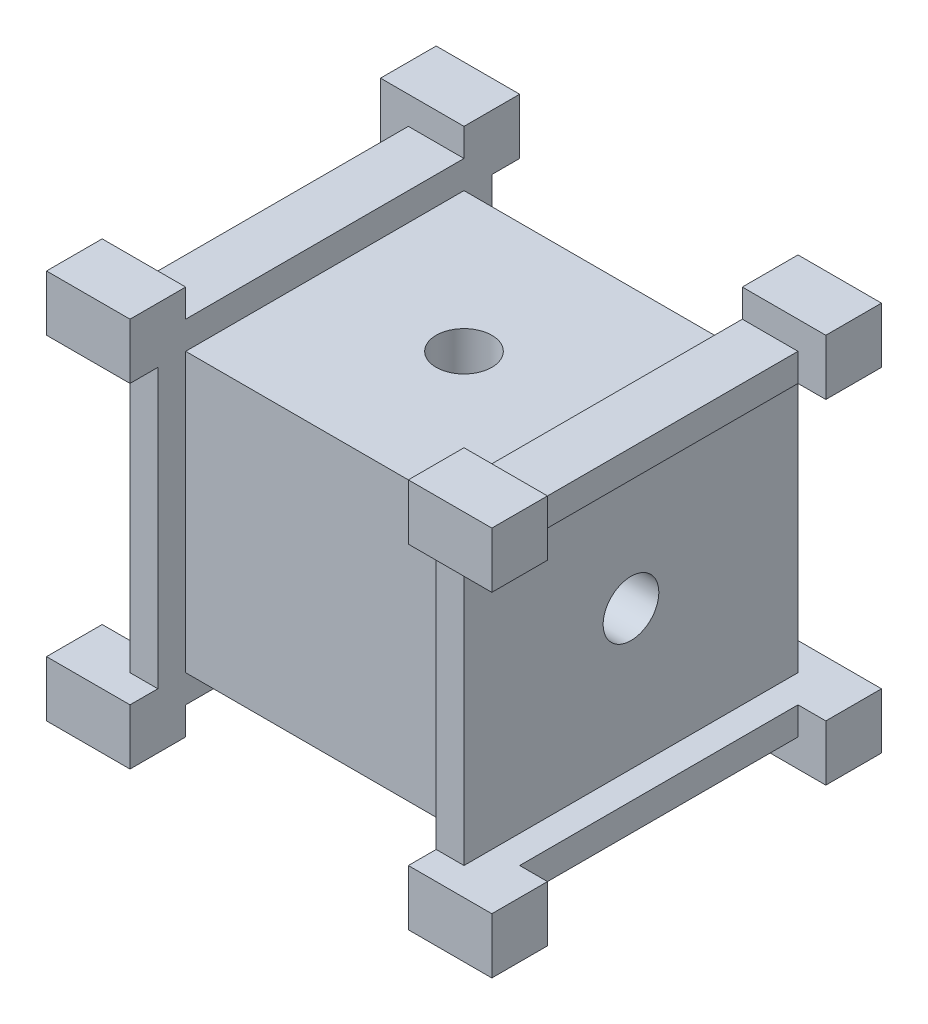
from build123d import *

# Parameters (mm, degrees)
SKETCH1_W            = 12
SKETCH1_H            = 12
BOSS_EXTRUDE1_DEPTH  = 12
SKETCH2_W            = 10
SKETCH2_H            = 12
CUT_EXTRUDE1_DEPTH   = 1
SKETCH3_W            = 10
SKETCH3_H            = 11
CUT_EXTRUDE2_DEPTH   = 1
SKETCH4_W            = 10
SKETCH4_H            = 11
CUT_EXTRUDE3_DEPTH   = 1
SKETCH5_W            = 10
SKETCH5_H            = 10
CUT_EXTRUDE4_DEPTH   = 1
SKETCH6_W            = 12
SKETCH6_H            = 1
BOSS_EXTRUDE2_DEPTH  = 1
SKETCH7_W            = 12
SKETCH7_H            = 1
BOSS_EXTRUDE3_DEPTH  = 1
SKETCH8_W            = 12
SKETCH8_H            = 1
BOSS_EXTRUDE4_DEPTH  = 1
SKETCH12_W           = 2
SKETCH12_H           = 1
BOSS_EXTRUDE5_DEPTH  = 1
SKETCH13_W           = 2
SKETCH13_H           = 1
BOSS_EXTRUDE6_DEPTH  = 1
SKETCH14_W           = 2
SKETCH14_H           = 1
BOSS_EXTRUDE7_DEPTH  = 1
SKETCH16_W           = 2
SKETCH16_H           = 1
BOSS_EXTRUDE8_DEPTH  = 1
SKETCH19_W           = 2
SKETCH19_H           = 1
BOSS_EXTRUDE10_DEPTH = 1
SKETCH20_W           = 2
SKETCH20_H           = 1
BOSS_EXTRUDE11_DEPTH = 1
SKETCH21_W           = 2
SKETCH21_H           = 1
BOSS_EXTRUDE12_DEPTH = 1
SKETCH22_W           = 2
SKETCH22_H           = 1
BOSS_EXTRUDE13_DEPTH = 1
SKETCH23_W           = 1
SKETCH23_H           = 2
BOSS_EXTRUDE15_DEPTH = 1
SKETCH24_W           = 3
SKETCH24_H           = 2
BOSS_EXTRUDE16_DEPTH = 1
SKETCH25_W           = 1
SKETCH25_H           = 2
BOSS_EXTRUDE17_DEPTH = 1
SKETCH26_W           = 1
SKETCH26_H           = 2
BOSS_EXTRUDE19_DEPTH = 1
SKETCH28_W           = 1
SKETCH28_H           = 2
BOSS_EXTRUDE20_DEPTH = 1
SKETCH29_W           = 1
SKETCH29_H           = 2
BOSS_EXTRUDE21_DEPTH = 1
SKETCH30_W           = 1
SKETCH30_H           = 2
BOSS_EXTRUDE22_DEPTH = 1
SKETCH31_W           = 1
SKETCH31_H           = 2
BOSS_EXTRUDE24_DEPTH = 1
SKETCH33_W           = 1
SKETCH33_H           = 2
BOSS_EXTRUDE25_DEPTH = 1
SKETCH34_W           = 3
SKETCH34_H           = 2
BOSS_EXTRUDE26_DEPTH = 1
SKETCH35_W           = 3
SKETCH35_H           = 2
BOSS_EXTRUDE27_DEPTH = 1
SKETCH36_W           = 3
SKETCH36_H           = 2
BOSS_EXTRUDE28_DEPTH = 1
SKETCH37_W           = 3
SKETCH37_H           = 2
BOSS_EXTRUDE29_DEPTH = 1
SKETCH38_W           = 3
SKETCH38_H           = 2
BOSS_EXTRUDE30_DEPTH = 1
SKETCH39_W           = 3
SKETCH39_H           = 2
BOSS_EXTRUDE31_DEPTH = 1
SKETCH40_W           = 3
SKETCH40_H           = 2
BOSS_EXTRUDE32_DEPTH = 1
SKETCH41_R           = 1
CUT_EXTRUDE6_DEPTH   = 12
SKETCH42_R           = 1
CUT_EXTRUDE7_DEPTH   = 12


with BuildPart() as part:
    # Sketch1 → Boss-Extrude1 (new body)
    with BuildSketch(Plane.XY):
        Rectangle(SKETCH1_W, SKETCH1_H)
    extrude(amount=BOSS_EXTRUDE1_DEPTH)

    # Sketch2 → Cut-Extrude1 (cut)
    with BuildSketch(Plane.XY.offset(12)):
        Rectangle(SKETCH2_W, SKETCH2_H)
    extrude(amount=-CUT_EXTRUDE1_DEPTH, mode=Mode.SUBTRACT)

    # Sketch3 → Cut-Extrude2 (cut)
    with BuildSketch(Plane(origin=(0, -6, 0), x_dir=(-1, 0, 0), z_dir=(0, -1, 0))):
        with Locations((0, -5.5)):
            Rectangle(SKETCH3_W, SKETCH3_H)
    extrude(amount=-CUT_EXTRUDE2_DEPTH, mode=Mode.SUBTRACT)

    # Sketch4 → Cut-Extrude3 (cut)
    with BuildSketch(Plane(origin=(0, 0, 0), x_dir=(-1, 0, 0), z_dir=(0, 0, -1))):
        with Locations((0, 0.5)):
            Rectangle(SKETCH4_W, SKETCH4_H)
    extrude(amount=-CUT_EXTRUDE3_DEPTH, mode=Mode.SUBTRACT)

    # Sketch5 → Cut-Extrude4 (cut)
    with BuildSketch(Plane(origin=(0, 6, 0), x_dir=(1, 0, 0), z_dir=(0, 1, 0))):
        with Locations((0, -6)):
            Rectangle(SKETCH5_W, SKETCH5_H)
    extrude(amount=-CUT_EXTRUDE4_DEPTH, mode=Mode.SUBTRACT)

    # Sketch6 → Boss-Extrude2 (add)
    with BuildSketch(Plane.ZY.offset(6)):
        with Locations((6, -5.5)):
            Rectangle(SKETCH6_W, SKETCH6_H)
    extrude(amount=BOSS_EXTRUDE2_DEPTH)

    # Sketch7 → Boss-Extrude3 (add)
    with BuildSketch(Plane.ZY.offset(6)):
        with Locations((6, 5.5)):
            Rectangle(SKETCH7_W, SKETCH7_H)
    extrude(amount=BOSS_EXTRUDE3_DEPTH)

    # Sketch8 → Boss-Extrude4 (add)
    with BuildSketch(Plane(origin=(6, 0, 0), x_dir=(0, 0, -1), z_dir=(1, 0, 0))):
        with Locations((-6, 5.5)):
            Rectangle(SKETCH8_W, SKETCH8_H)
        with Locations((-6, -5.5)):
            Rectangle(SKETCH8_W, SKETCH8_H)
    extrude(amount=BOSS_EXTRUDE4_DEPTH)

    # Sketch12 → Boss-Extrude5 (add)
    with BuildSketch(Plane(origin=(0, -6, 0), x_dir=(-1, 0, 0), z_dir=(0, -1, 0))):
        with Locations((-6, -0.5)):
            Rectangle(SKETCH12_W, SKETCH12_H)
    extrude(amount=BOSS_EXTRUDE5_DEPTH)

    # Sketch13 → Boss-Extrude6 (add)
    with BuildSketch(Plane(origin=(0, -6, 0), x_dir=(-1, 0, 0), z_dir=(0, -1, 0))):
        with Locations((-6, -11.5)):
            Rectangle(SKETCH13_W, SKETCH13_H)
    extrude(amount=BOSS_EXTRUDE6_DEPTH)

    # Sketch14 → Boss-Extrude7 (add)
    with BuildSketch(Plane(origin=(0, -6, 0), x_dir=(-1, 0, 0), z_dir=(0, -1, 0))):
        with Locations((6, -0.5)):
            Rectangle(SKETCH14_W, SKETCH14_H)
    extrude(amount=BOSS_EXTRUDE7_DEPTH)

    # Sketch16 → Boss-Extrude8 (add)
    with BuildSketch(Plane(origin=(0, -6, 0), x_dir=(-1, 0, 0), z_dir=(0, -1, 0))):
        with Locations((6, -11.5)):
            Rectangle(SKETCH16_W, SKETCH16_H)
    extrude(amount=BOSS_EXTRUDE8_DEPTH)

    # Sketch19 → Boss-Extrude10 (add)
    with BuildSketch(Plane(origin=(0, 6, 0), x_dir=(1, 0, 0), z_dir=(0, 1, 0))):
        with Locations((6, -11.5)):
            Rectangle(SKETCH19_W, SKETCH19_H)
    extrude(amount=BOSS_EXTRUDE10_DEPTH)

    # Sketch20 → Boss-Extrude11 (add)
    with BuildSketch(Plane(origin=(0, 6, 0), x_dir=(1, 0, 0), z_dir=(0, 1, 0))):
        with Locations((-6, -11.5)):
            Rectangle(SKETCH20_W, SKETCH20_H)
    extrude(amount=BOSS_EXTRUDE11_DEPTH)

    # Sketch21 → Boss-Extrude12 (add)
    with BuildSketch(Plane(origin=(0, 6, 0), x_dir=(1, 0, 0), z_dir=(0, 1, 0))):
        with Locations((6, -0.5)):
            Rectangle(SKETCH21_W, SKETCH21_H)
    extrude(amount=BOSS_EXTRUDE12_DEPTH)

    # Sketch22 → Boss-Extrude13 (add)
    with BuildSketch(Plane(origin=(0, 6, 0), x_dir=(1, 0, 0), z_dir=(0, 1, 0))):
        with Locations((-6, -0.5)):
            Rectangle(SKETCH22_W, SKETCH22_H)
    extrude(amount=BOSS_EXTRUDE13_DEPTH)

    # Sketch23 → Boss-Extrude15 (add)
    with BuildSketch(Plane(origin=(7, 0, 0), x_dir=(0, 0, -1), z_dir=(1, 0, 0))):
        with Locations((-11.5, 6)):
            Rectangle(SKETCH23_W, SKETCH23_H)
    extrude(amount=BOSS_EXTRUDE15_DEPTH)

    # Sketch24 → Boss-Extrude16 (add)
    with BuildSketch(Plane.XY.offset(12)):
        with Locations((6.5, 6)):
            Rectangle(SKETCH24_W, SKETCH24_H)
    extrude(amount=BOSS_EXTRUDE16_DEPTH)

    # Sketch25 → Boss-Extrude17 (add)
    with BuildSketch(Plane(origin=(7, 0, 0), x_dir=(0, 0, -1), z_dir=(1, 0, 0))):
        with Locations((-11.5, -6)):
            Rectangle(SKETCH25_W, SKETCH25_H)
    extrude(amount=BOSS_EXTRUDE17_DEPTH)

    # Sketch26 → Boss-Extrude19 (add)
    with BuildSketch(Plane(origin=(7, 0, 0), x_dir=(0, 0, -1), z_dir=(1, 0, 0))):
        with Locations((-0.5, -6)):
            Rectangle(SKETCH26_W, SKETCH26_H)
    extrude(amount=BOSS_EXTRUDE19_DEPTH)

    # Sketch28 → Boss-Extrude20 (add)
    with BuildSketch(Plane(origin=(7, 0, 0), x_dir=(0, 0, -1), z_dir=(1, 0, 0))):
        with Locations((-0.5, 6)):
            Rectangle(SKETCH28_W, SKETCH28_H)
    extrude(amount=BOSS_EXTRUDE20_DEPTH)

    # Sketch29 → Boss-Extrude21 (add)
    with BuildSketch(Plane.ZY.offset(7)):
        with Locations((0.5, 6)):
            Rectangle(SKETCH29_W, SKETCH29_H)
    extrude(amount=BOSS_EXTRUDE21_DEPTH)

    # Sketch30 → Boss-Extrude22 (add)
    with BuildSketch(Plane.ZY.offset(7)):
        with Locations((11.5, 6)):
            Rectangle(SKETCH30_W, SKETCH30_H)
    extrude(amount=BOSS_EXTRUDE22_DEPTH)

    # Sketch31 → Boss-Extrude24 (add)
    with BuildSketch(Plane.ZY.offset(7)):
        with Locations((0.5, -6)):
            Rectangle(SKETCH31_W, SKETCH31_H)
    extrude(amount=BOSS_EXTRUDE24_DEPTH)

    # Sketch33 → Boss-Extrude25 (add)
    with BuildSketch(Plane.ZY.offset(7)):
        with Locations((11.5, -6)):
            Rectangle(SKETCH33_W, SKETCH33_H)
    extrude(amount=BOSS_EXTRUDE25_DEPTH)

    # Sketch34 → Boss-Extrude26 (add)
    with BuildSketch(Plane.XY.offset(12)):
        with Locations((-6.5, 6)):
            Rectangle(SKETCH34_W, SKETCH34_H)
    extrude(amount=BOSS_EXTRUDE26_DEPTH)

    # Sketch35 → Boss-Extrude27 (add)
    with BuildSketch(Plane.XY.offset(12)):
        with Locations((-6.5, -6)):
            Rectangle(SKETCH35_W, SKETCH35_H)
    extrude(amount=BOSS_EXTRUDE27_DEPTH)

    # Sketch36 → Boss-Extrude28 (add)
    with BuildSketch(Plane.XY.offset(12)):
        with Locations((6.5, -6)):
            Rectangle(SKETCH36_W, SKETCH36_H)
    extrude(amount=BOSS_EXTRUDE28_DEPTH)

    # Sketch37 → Boss-Extrude29 (add)
    with BuildSketch(Plane(origin=(0, 0, 0), x_dir=(-1, 0, 0), z_dir=(0, 0, -1))):
        with Locations((-6.5, 6)):
            Rectangle(SKETCH37_W, SKETCH37_H)
    extrude(amount=BOSS_EXTRUDE29_DEPTH)

    # Sketch38 → Boss-Extrude30 (add)
    with BuildSketch(Plane(origin=(0, 0, 0), x_dir=(-1, 0, 0), z_dir=(0, 0, -1))):
        with Locations((-6.5, -6)):
            Rectangle(SKETCH38_W, SKETCH38_H)
    extrude(amount=BOSS_EXTRUDE30_DEPTH)

    # Sketch39 → Boss-Extrude31 (add)
    with BuildSketch(Plane(origin=(0, 0, 0), x_dir=(-1, 0, 0), z_dir=(0, 0, -1))):
        with Locations((6.5, -6)):
            Rectangle(SKETCH39_W, SKETCH39_H)
    extrude(amount=BOSS_EXTRUDE31_DEPTH)

    # Sketch40 → Boss-Extrude32 (add)
    with BuildSketch(Plane(origin=(0, 0, 0), x_dir=(-1, 0, 0), z_dir=(0, 0, -1))):
        with Locations((6.5, 6)):
            Rectangle(SKETCH40_W, SKETCH40_H)
    extrude(amount=BOSS_EXTRUDE32_DEPTH)

    # Sketch41 → Cut-Extrude6 (cut)
    with BuildSketch(Plane(origin=(6, 0, 0), x_dir=(0, 0, -1), z_dir=(1, 0, 0))):
        with Locations((-6, 0)):
            Circle(SKETCH41_R)
    extrude(amount=-CUT_EXTRUDE6_DEPTH, mode=Mode.SUBTRACT)

    # Sketch42 → Cut-Extrude7 (cut)
    with BuildSketch(Plane(origin=(0, -5, 0), x_dir=(-1, 0, 0), z_dir=(0, -1, 0))):
        with Locations(Location((0, -6, 0), (0, 0, 90))):
            Circle(SKETCH42_R)
    extrude(amount=-CUT_EXTRUDE7_DEPTH, mode=Mode.SUBTRACT)


solid = part.part
